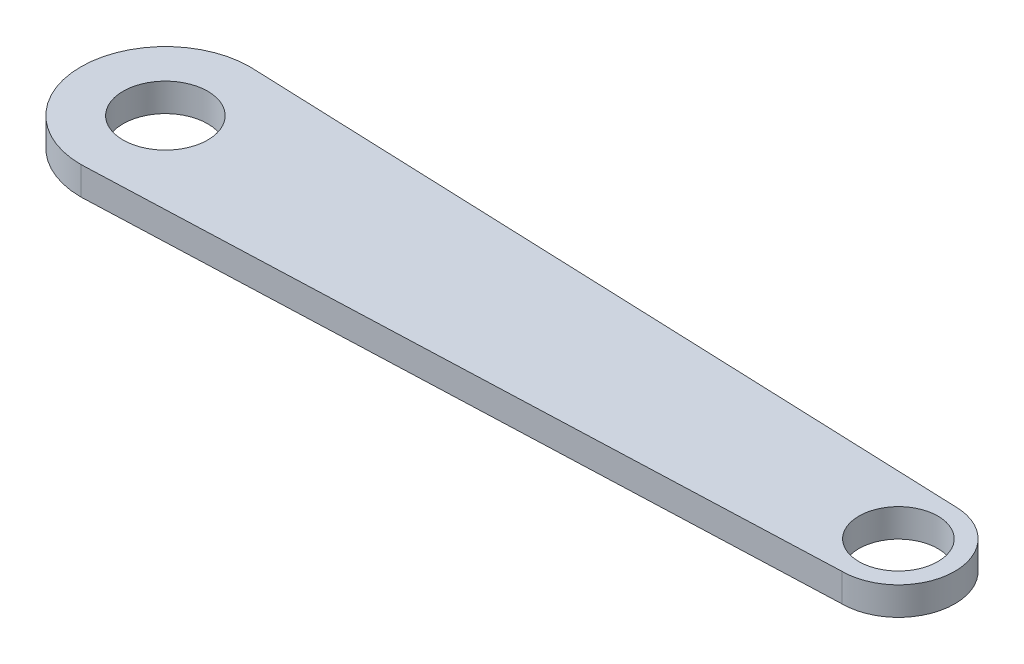
from build123d import *

# Parameters (mm, degrees)
BOSS_EXTRUDE1_DEPTH = 5
SKETCH4_R           = 7
SKETCH4_R_2         = 7.5
CUT_EXTRUDE1_DEPTH  = 10


with BuildPart() as part:
    # Sketch3 → Boss-Extrude1 (new body)
    with BuildSketch(Plane(origin=(0, 0, 0), x_dir=(1, 0, 0), z_dir=(0, 1, 0))):
        with BuildLine():
            Line((-115.540454706, 15), (14.459545294, 10))
            ThreePointArc((14.459545294, 10), (24.459545294, 0), (14.459545294, -10))
            Line((14.459545294, -10), (-115.540454706, -15))
            ThreePointArc((-115.540454706, -15), (-130.540454706, 0), (-115.540454706, 15))
        make_face()
    extrude(amount=BOSS_EXTRUDE1_DEPTH)

    # Sketch4 → Cut-Extrude1 (cut)
    with BuildSketch(Plane.XZ):
        with Locations(Location((14.459545294, 0, 0), (0, 0, 270))):
            Circle(SKETCH4_R)
        with Locations(Location((-115.540454706, 0, 0), (0, 0, 270))):
            Circle(SKETCH4_R_2)
    extrude(amount=-CUT_EXTRUDE1_DEPTH, mode=Mode.SUBTRACT)


solid = part.part
